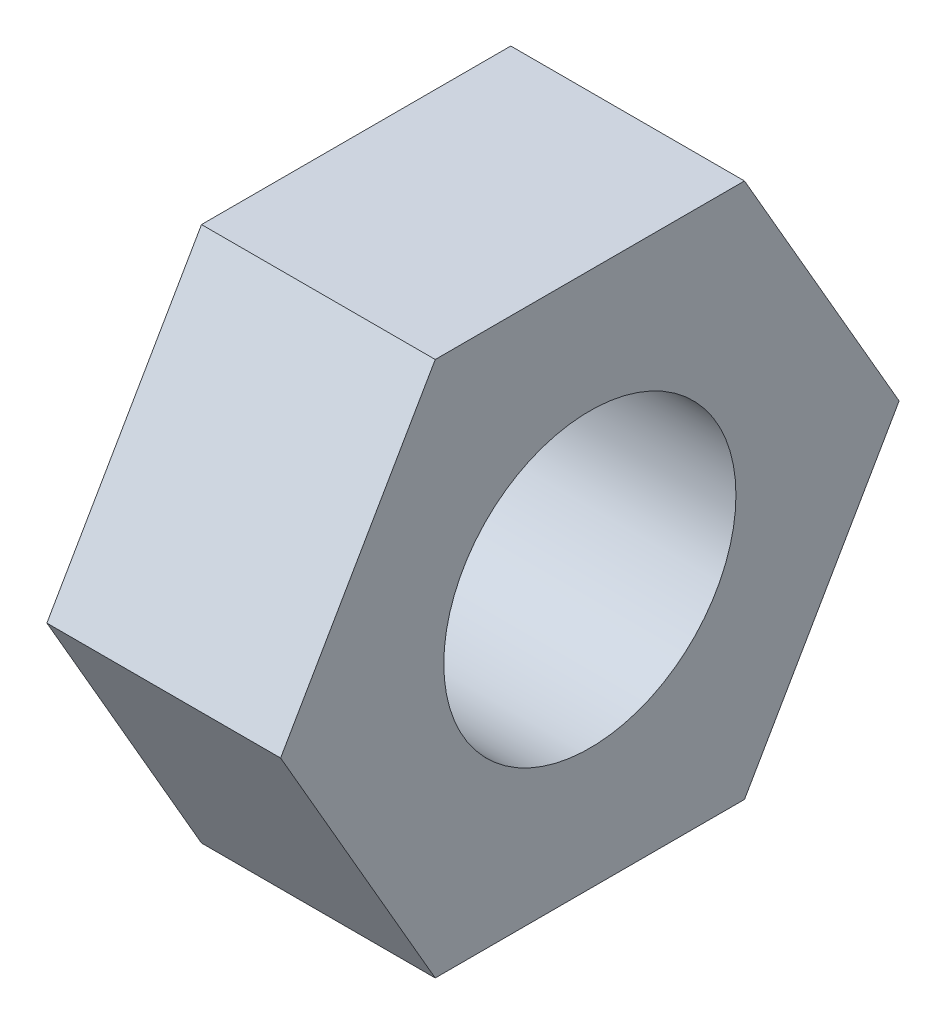
from build123d import *

# Parameters (mm, degrees)
NUT_DEPTH       = 2.4
THREAD_SKETCH_W = 4.4
THREAD_SKETCH_H = 1.5


with BuildPart() as part:
    # Nut Sketch → Nut (new body)
    with BuildSketch(Plane(origin=(0, 0, 0), x_dir=(0, 0, -1), z_dir=(1, 0, 0))):
        Polygon((3.175426481, 0), (1.58771324, 2.75), (-1.58771324, 2.75), (-3.175426481, 0), (-1.58771324, -2.75), (1.58771324, -2.75), align=None)
    extrude(amount=NUT_DEPTH)

    # Thread Sketch → Thread (revolve, cut)
    with BuildSketch(Plane.XY):
        with Locations((1.2, 0.75)):
            Rectangle(THREAD_SKETCH_W, THREAD_SKETCH_H)
    revolve(axis=Axis((-1000, 0, 0), (1, 0, 0)), mode=Mode.SUBTRACT)


solid = part.part
